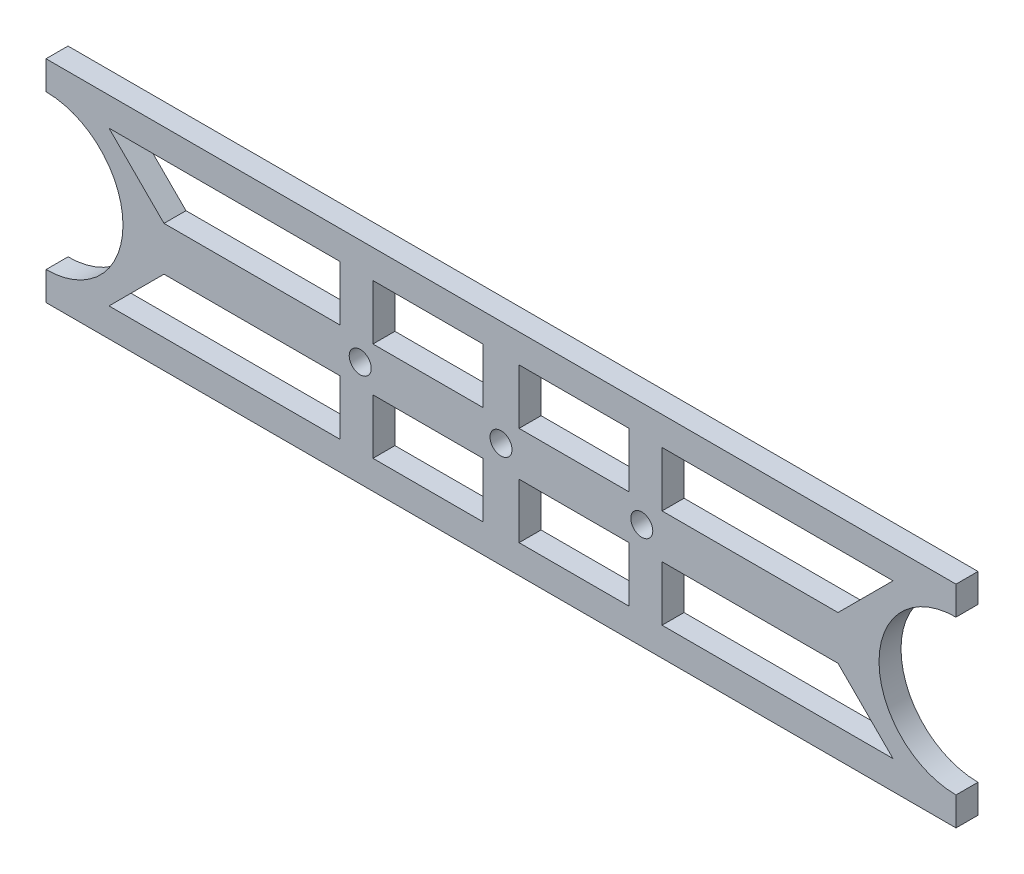
from build123d import *

# Parameters (mm, degrees)
SKETCH1_W           = 206.856
SKETCH1_H           = 48
SKETCH1_R           = 2.5
BOSS_EXTRUDE1_DEPTH = 5
SKETCH2_R           = 17.5
SKETCH2_W           = 25
SKETCH2_H           = 12.5
CUT_EXTRUDE1_DEPTH  = 107.293702466


with BuildPart() as part:
    # Sketch1 → Boss-Extrude1 (new body)
    with BuildSketch(Plane.XY):
        Rectangle(SKETCH1_W, SKETCH1_H)
        Circle(SKETCH1_R, mode=Mode.SUBTRACT)
        with Locations((32, 0)):
            Circle(SKETCH1_R, mode=Mode.SUBTRACT)
        with Locations((-32, 0)):
            Circle(SKETCH1_R, mode=Mode.SUBTRACT)
    extrude(amount=BOSS_EXTRUDE1_DEPTH)

    # Sketch2 → Cut-Extrude1 (cut, through all)
    with BuildSketch(Plane.XY.offset(5)):
        with Locations((103.428, 0)):
            Circle(SKETCH2_R)
        Polygon((89.108194847, 17.5), (36.608194847, 17.5), (36.608194847, 5), (76.608194847, 5), align=None)
        with Locations((16.608194847, 11.25)):
            Rectangle(SKETCH2_W, SKETCH2_H)
        Polygon((89.108194847, -17.5), (36.608194847, -17.5), (36.608194847, -5), (76.608194847, -5), align=None)
        with Locations((16.608194847, -11.25)):
            Rectangle(SKETCH2_W, SKETCH2_H)
    cut_extrude1 = extrude(amount=-CUT_EXTRUDE1_DEPTH, mode=Mode.SUBTRACT)

    # Mirror1: Cut-Extrude1 across plane
    add(cut_extrude1.mirror(Plane(origin=(0, 0, 0), x_dir=(0, 0, 1), z_dir=(1, 0, 0))), mode=Mode.SUBTRACT)


solid = part.part
